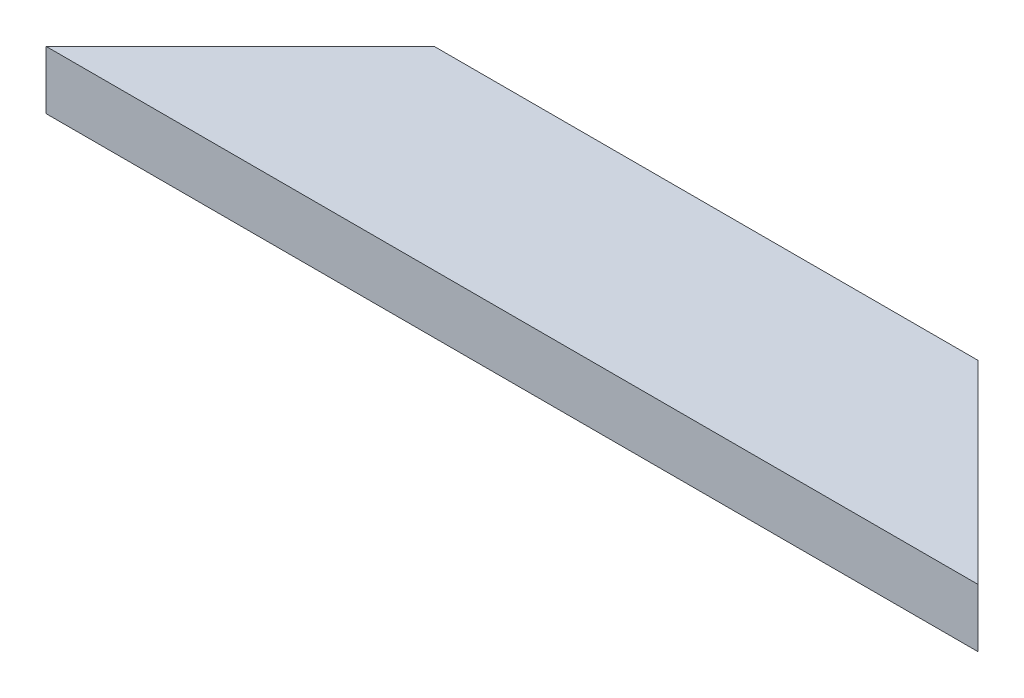
from build123d import *

# Parameters (mm, degrees)
BOSS_EXTRUDE1_DEPTH = 19.05


with BuildPart() as part:
    # Sketch1 → Boss-Extrude1 (new body)
    with BuildSketch(Plane(origin=(0, 0, 0), x_dir=(1, 0, 0), z_dir=(0, 1, 0))):
        Polygon((-106.060551681, 52.978844793), (71.739448319, 52.978844793), (135.168830647, -10.450537534), (-169.489934009, -10.450537534), align=None)
    extrude(amount=BOSS_EXTRUDE1_DEPTH)


solid = part.part
